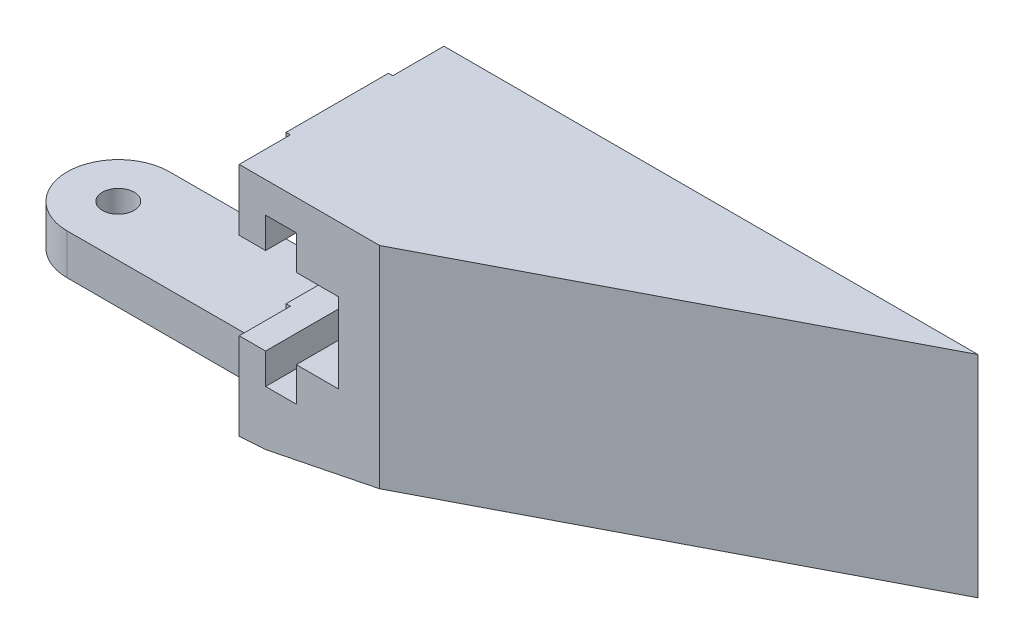
from build123d import *

# Parameters (mm, degrees)
EXTRUDE_1_DEPTH          = 20
CUT_EXTRUDE_1_DEPTH      = 49.817301935
CUT_EXTRUDE_1_DEPTH_BACK = 49.817301935
CUT_EXTRUDE_2_DEPTH      = 50.88447801
CUT_EXTRUDE_2_DEPTH_BACK = 50.88447801
SKETCH_3_W               = 26.81134726
SKETCH_3_H               = 5
CUT_EXTRUDE_3_DEPTH      = 50.88447801
CUT_EXTRUDE_3_DEPTH_BACK = 50.88447801
CUT_EXTRUDE_4_DEPTH      = 50.88447801
CUT_EXTRUDE_4_DEPTH_BACK = 50.88447801
SKETCH_5_R               = 1.55


with BuildPart() as part:
    # 草图1 → 凸台-拉伸1 (new body)
    with BuildSketch(Plane.XY):
        Polygon((-13.100304314, 11.5), (39.490013248, 11.5), (39.490013248, -9.083192704), (1.044300056, -9.083192704), (-7.416317872, -10.795276425), (-10.024002967, -11.323036202), (-12.678665988, -11.5), (-39.490013248, -11.5), (-39.490013248, -7.536083067), (-13.100304314, -7.5), (-13.100304314, -3), (-10.100304314, -3), (-10.100304314, -6), (-7.100304314, -6), (-7.100304314, -2.65), (-3.000304314, -2.65), (-3.000304314, 5.15), (-7.100304314, 5.15), (-7.100304314, 8.5), (-10.100304314, 8.5), (-10.100304314, 5.5), (-13.100304314, 5.5), align=None)
    extrude(amount=EXTRUDE_1_DEPTH)

    # 草图2 → 切除-拉伸1 (cut, two sides: drawn at the far end of the back side and taken through both)
    with BuildSketch(Plane.XZ.offset(9.083192704).offset(-CUT_EXTRUDE_1_DEPTH_BACK)):
        Polygon((1.044300056, 20), (39.490013248, 0), (39.490013248, 20), align=None)
    extrude(amount=CUT_EXTRUDE_1_DEPTH + CUT_EXTRUDE_1_DEPTH_BACK, mode=Mode.SUBTRACT)

    # 草图3 → 切除-拉伸2 (cut, two sides: drawn at the far end of the back side and taken through both)
    with BuildSketch(Plane.XZ.offset(11.5).offset(-CUT_EXTRUDE_2_DEPTH_BACK)):
        with Locations((-26.084339618, 17.5)):
            Rectangle(SKETCH_3_W, SKETCH_3_H)
        with Locations((-26.084339618, 2.5)):
            Rectangle(SKETCH_3_W, SKETCH_3_H)
    extrude(amount=CUT_EXTRUDE_2_DEPTH + CUT_EXTRUDE_2_DEPTH_BACK, mode=Mode.SUBTRACT)

    # 草图4 → 切除-拉伸3 (cut, two sides: drawn at the far end of the back side and taken through both)
    with BuildSketch(Plane.XZ.offset(11.5).offset(-CUT_EXTRUDE_3_DEPTH_BACK)):
        with BuildLine():
            ThreePointArc((-39.490013248, 10), (-38.025547154, 13.535533906), (-34.490013248, 15))
            Line((-34.490013248, 15), (-39.490013248, 15))
            Line((-39.490013248, 15), (-39.490013248, 10))
        make_face()
        with BuildLine():
            ThreePointArc((-34.490013248, 5), (-38.025547154, 6.464466094), (-39.490013248, 10))
            Line((-39.490013248, 10), (-39.490013248, 5))
            Line((-39.490013248, 5), (-34.490013248, 5))
        make_face()
    extrude(amount=CUT_EXTRUDE_3_DEPTH + CUT_EXTRUDE_3_DEPTH_BACK, mode=Mode.SUBTRACT)

    # 草图5 → 切除-拉伸4 (cut, two sides: drawn at the far end of the back side and taken through both)
    with BuildSketch(Plane.XZ.offset(11.5).offset(-CUT_EXTRUDE_4_DEPTH_BACK)):
        with Locations(Location((-34.490013248, 10, 0), (0, 0, 180))):
            Circle(SKETCH_5_R)
    extrude(amount=CUT_EXTRUDE_4_DEPTH + CUT_EXTRUDE_4_DEPTH_BACK, mode=Mode.SUBTRACT)


solid = part.part
